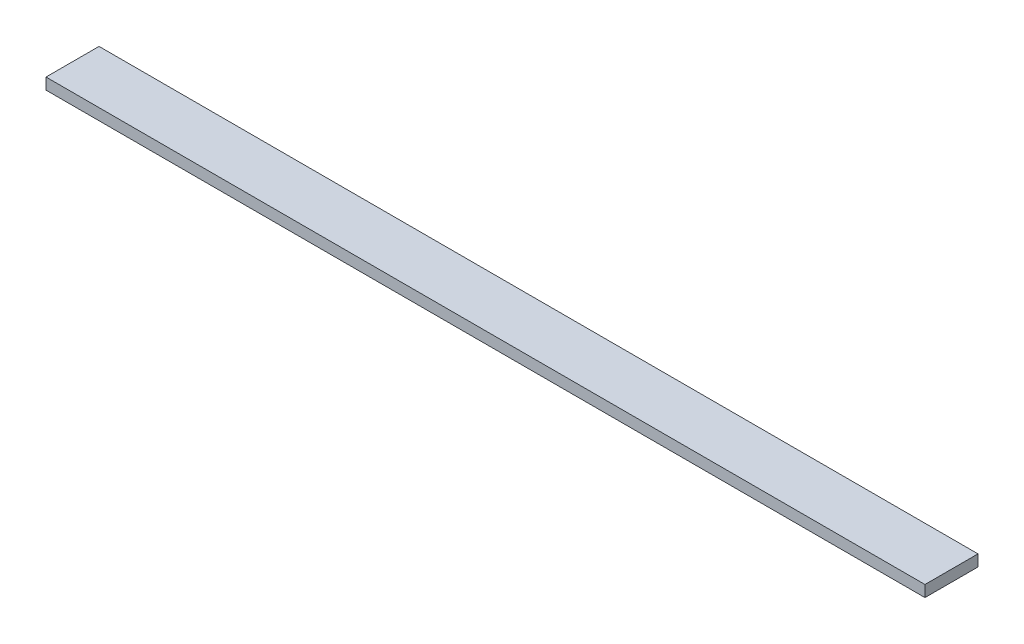
from build123d import *

# Parameters (mm, degrees)
PACK_PANO_KLEMENS_RAYI_1_START = -213
SKETCH1_W                      = 580
SKETCH1_H                      = 7.5
PACK_PANO_KLEMENS_RAYI_1_DEPTH = 35


with BuildPart() as part:
    # Sketch1 → PACK_pano_klemens_rayi_1 (new body)
    with BuildSketch(Plane.XY.offset(PACK_PANO_KLEMENS_RAYI_1_START)):
        with Locations((350, 143.75)):
            Rectangle(SKETCH1_W, SKETCH1_H)
    extrude(amount=-PACK_PANO_KLEMENS_RAYI_1_DEPTH)


solid = part.part
